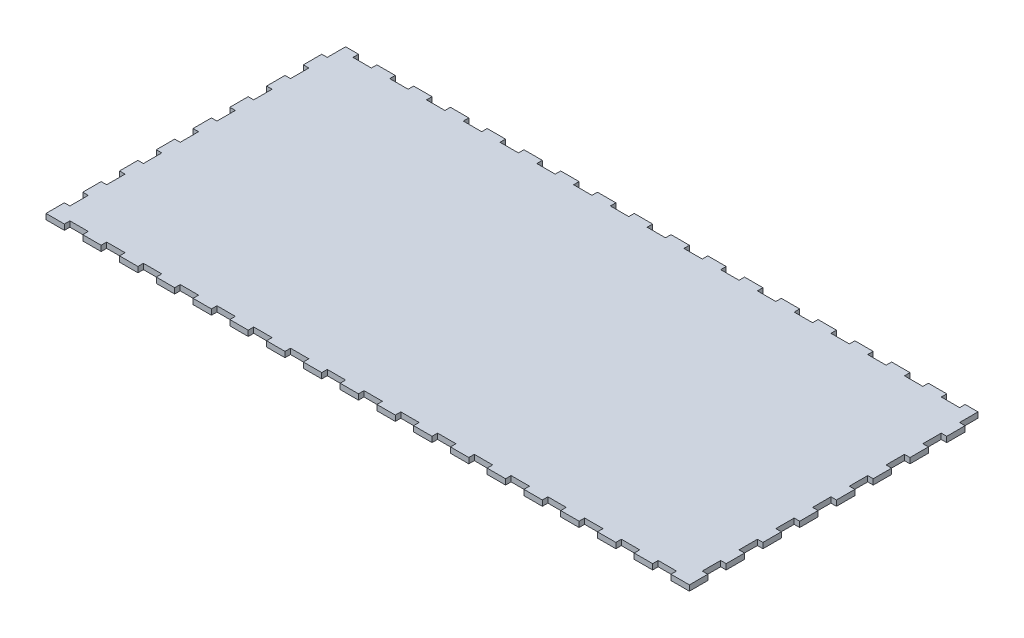
from build123d import *

# Parameters (mm, degrees)
SALIENTE_EXTRUIR1_DEPTH = 3


with BuildPart() as part:
    # Croquis1 → Saliente-Extruir1 (new body)
    with BuildSketch(Plane(origin=(0, 0, 0), x_dir=(1, 0, 0), z_dir=(0, 1, 0))):
        Polygon((165, -80), (175, -80), (175, -70), (172, -70), (172, -60), (175, -60), (175, -50), (172, -50), (172, -40), (175, -40), (175, -30), (172, -30), (172, -20), (175, -20), (175, -10), (172, -10), (172, 0), (175, 0), (175, 10), (172, 10), (172, 20), (175, 20), (175, 30), (172, 30), (172, 40), (175, 40), (175, 50), (172, 50), (172, 60), (175, 60), (175, 70), (172, 70), (172, 80), (165, 80), (165, 77), (155, 77), (155, 80), (145, 80), (145, 77), (135, 77), (135, 80), (125, 80), (125, 77), (115, 77), (115, 80), (105, 80), (105, 77), (95, 77), (95, 80), (85, 80), (85, 77), (75, 77), (75, 80), (65, 80), (65, 77), (55, 77), (55, 80), (45, 80), (45, 77), (35, 77), (35, 80), (25, 80), (25, 77), (15, 77), (15, 80), (5, 80), (5, 77), (-5, 77), (-5, 80), (-15, 80), (-15, 77), (-25, 77), (-25, 80), (-35, 80), (-35, 77), (-45, 77), (-45, 80), (-55, 80), (-55, 77), (-65, 77), (-65, 80), (-75, 80), (-75, 77), (-85, 77), (-85, 80), (-95, 80), (-95, 77), (-105, 77), (-105, 80), (-115, 80), (-115, 77), (-125, 77), (-125, 80), (-135, 80), (-135, 77), (-145, 77), (-145, 80), (-155, 80), (-155, 77), (-165, 77), (-165, 80), (-172, 80), (-172, 70), (-175, 70), (-175, 60), (-172, 60), (-172, 50), (-175, 50), (-175, 40), (-172, 40), (-172, 30), (-175, 30), (-175, 20), (-172, 20), (-172, 10), (-175, 10), (-175, 0), (-172, 0), (-172, -10), (-175, -10), (-175, -20), (-172, -20), (-172, -30), (-175, -30), (-175, -40), (-172, -40), (-172, -50), (-175, -50), (-175, -60), (-172, -60), (-172, -70), (-175, -70), (-175, -80), (-165, -80), (-165, -77), (-155, -77), (-155, -80), (-145, -80), (-145, -77), (-135, -77), (-135, -80), (-125, -80), (-125, -77), (-115, -77), (-115, -80), (-105, -80), (-105, -77), (-95, -77), (-95, -80), (-85, -80), (-85, -77), (-75, -77), (-75, -80), (-65, -80), (-65, -77), (-55, -77), (-55, -80), (-45, -80), (-45, -77), (-35, -77), (-35, -80), (-25, -80), (-25, -77), (-15, -77), (-15, -80), (-5, -80), (-5, -77), (5, -77), (5, -80), (15, -80), (15, -77), (25, -77), (25, -80), (35, -80), (35, -77), (45, -77), (45, -80), (55, -80), (55, -77), (65, -77), (65, -80), (75, -80), (75, -77), (85, -77), (85, -80), (95, -80), (95, -77), (105, -77), (105, -80), (115, -80), (115, -77), (125, -77), (125, -80), (135, -80), (135, -77), (145, -77), (145, -80), (155, -80), (155, -77), (165, -77), align=None)
    extrude(amount=SALIENTE_EXTRUIR1_DEPTH)


solid = part.part
